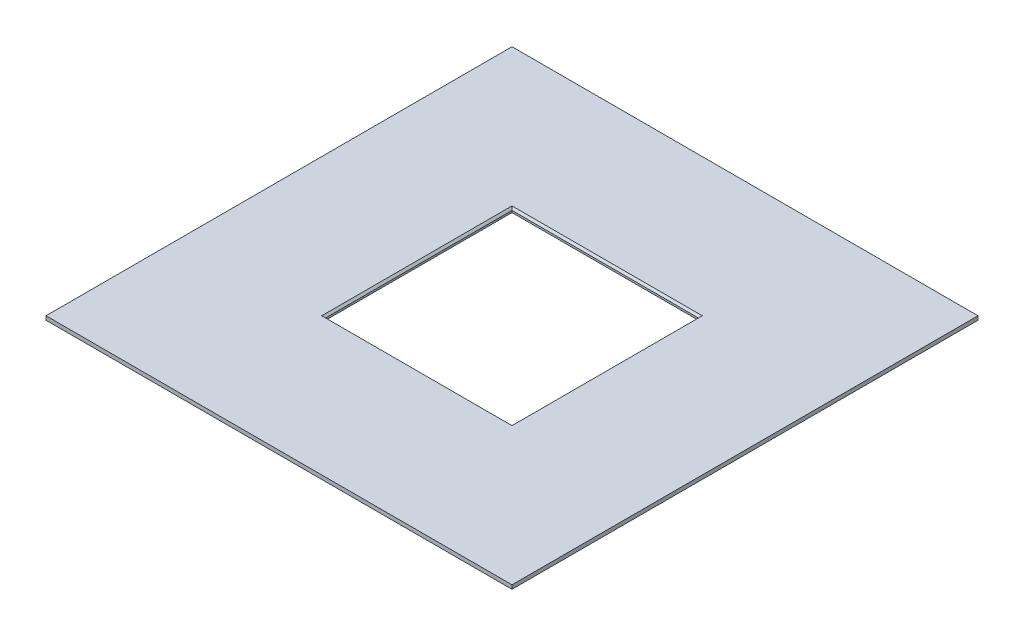
from build123d import *

# Parameters (mm, degrees)
SKETCH1_W           = 120
SKETCH1_H           = 120
SKETCH1_W_2         = 48
SKETCH1_H_2         = 48
BOSS_EXTRUDE1_DEPTH = 1
CHAMFER1_SIZE       = 0.5


with BuildPart() as part:
    # Sketch1 → Boss-Extrude1 (new body)
    with BuildSketch(Plane(origin=(0, 0, 0), x_dir=(1, 0, 0), z_dir=(0, 1, 0))):
        Rectangle(SKETCH1_W, SKETCH1_H)
        Rectangle(SKETCH1_W_2, SKETCH1_H_2, mode=Mode.SUBTRACT)
    extrude(amount=BOSS_EXTRUDE1_DEPTH)

    # Chamfer1
    chamfer1_edges = [part.edges().sort_by_distance(p)[0] for p in [
        (24, 1, 0),
        (0, 1, -24),
        (-24, 1, 0),
        (0, 1, 24),
    ]]
    chamfer(chamfer1_edges, length=CHAMFER1_SIZE)


solid = part.part
